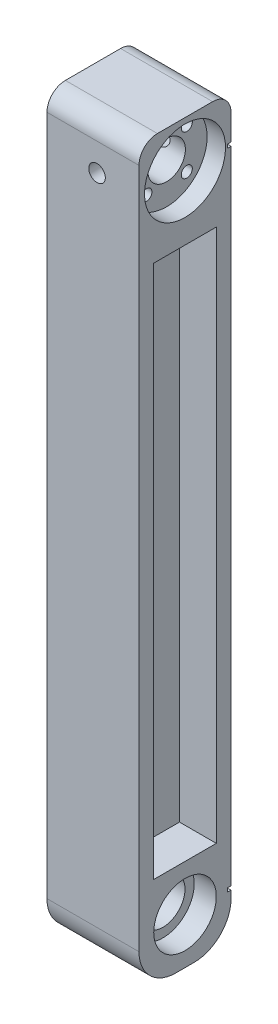
from build123d import *

# Parameters (mm, degrees)
CROQUIS1_W              = 25
CROQUIS1_H              = 25
SALIENTE_EXTRUIR1_DEPTH = 200
REDONDEO1_R             = 10
REDONDEO2_R             = 10
REDONDEO3_R             = 5
REDONDEO4_R             = 5
CROQUIS2_R              = 11
CROQUIS2_R_2            = 8.5
CORTAR_EXTRUIR1_DEPTH   = 6
CORTAR_EXTRUIR2_START   = -6
CROQUIS3_R              = 8.5
CORTAR_EXTRUIR2_DEPTH   = 6
CROQUIS9_R              = 5.1
CROQUIS9_R_2            = 6
CORTAR_EXTRUIR6_DEPTH   = 30
CROQUIS13_W             = 1
CROQUIS13_H             = 5
CORTAR_EXTRUIR8_DEPTH   = 1
SALIENTE_EXTRUIR3_START = 1
CROQUIS14_R             = 11
CROQUIS14_R_2           = 5.1
SALIENTE_EXTRUIR3_DEPTH = 1
CROQUIS15_R             = 1.5
CORTAR_EXTRUIR9_DEPTH   = 16
CORTAR_EXTRUIR10_DEPTH  = 11
CORTAR_EXTRUIR12_REACH  = 205.101
CROQUIS18_W             = 1
CROQUIS18_H             = 1
CROQUIS19_W             = 17
CROQUIS19_H             = 145
CORTAR_EXTRUIR13_DEPTH  = 10
CROQUIS20_W             = 17
CROQUIS20_H             = 145
CORTAR_EXTRUIR14_DEPTH  = 10
CROQUIS12_R             = 2.25
CORTAR_EXTRUIR7_DEPTH   = 204.100960116


with BuildPart() as part:
    # Croquis1 → Saliente-Extruir1 (new body)
    with BuildSketch(Plane(origin=(0, 0, 0), x_dir=(1, 0, 0), z_dir=(0, 1, 0))):
        with Locations((12.5, 12.5)):
            Rectangle(CROQUIS1_W, CROQUIS1_H)
    extrude(amount=SALIENTE_EXTRUIR1_DEPTH)

    # Redondeo1
    redondeo1_edges = [part.edges().sort_by_distance(p)[0] for p in [
        (12.5, 0, -25),
    ]]
    fillet(redondeo1_edges, radius=REDONDEO1_R)

    # Redondeo2
    redondeo2_edges = [part.edges().sort_by_distance(p)[0] for p in [
        (12.5, 0, 0),
    ]]
    fillet(redondeo2_edges, radius=REDONDEO2_R)

    # Redondeo3
    redondeo3_edges = [part.edges().sort_by_distance(p)[0] for p in [
        (12.5, 200, 0),
    ]]
    fillet(redondeo3_edges, radius=REDONDEO3_R)

    # Redondeo4
    redondeo4_edges = [part.edges().sort_by_distance(p)[0] for p in [
        (12.5, 200, -25),
    ]]
    fillet(redondeo4_edges, radius=REDONDEO4_R)

    # Croquis2 → Cortar-Extruir1 (cut)
    with BuildSketch(Plane(origin=(25, 0, 0), x_dir=(0, 0, -1), z_dir=(1, 0, 0))):
        with Locations((12.5, 187.5)):
            Circle(CROQUIS2_R)
        with Locations(Location((12.5, 12.5, 0), (0, 0, 180))):
            Circle(CROQUIS2_R_2)
    extrude(amount=-CORTAR_EXTRUIR1_DEPTH, mode=Mode.SUBTRACT)

    # Croquis3 → Cortar-Extruir2 (cut)
    with BuildSketch(Plane.ZY.offset(CORTAR_EXTRUIR2_START)):
        with Locations((-12.5, 12.5)):
            Circle(CROQUIS3_R)
        with Locations(Location((-12.5, 187.5, 0), (0, 0, 180))):
            Circle(CROQUIS3_R)
    extrude(amount=CORTAR_EXTRUIR2_DEPTH, mode=Mode.SUBTRACT)

    # Croquis9 → Cortar-Extruir6 (cut)
    with BuildSketch(Plane(origin=(19, 0, 0), x_dir=(0, 0, -1), z_dir=(1, 0, 0))):
        with Locations((12.5, 187.5)):
            Circle(CROQUIS9_R)
        with Locations((12.5, 12.5)):
            Circle(CROQUIS9_R_2)
    extrude(amount=-CORTAR_EXTRUIR6_DEPTH, mode=Mode.SUBTRACT)

    # Croquis13 → Cortar-Extruir8 (cut)
    with BuildSketch(Plane(origin=(0, 0, -25), x_dir=(-1, 0, 0), z_dir=(0, 0, -1))):
        with Locations((-12.5, 187.04733642)):
            Rectangle(CROQUIS13_W, CROQUIS13_H)
    extrude(amount=-CORTAR_EXTRUIR8_DEPTH, mode=Mode.SUBTRACT)

    # Croquis14 → Saliente-Extruir3 (add)
    with BuildSketch(Plane(origin=(19, 0, 0), x_dir=(0, 0, -1), z_dir=(1, 0, 0)).offset(SALIENTE_EXTRUIR3_START)):
        with Locations((12.5, 187.5)):
            Circle(CROQUIS14_R)
        with Locations((12.5, 187.5)):
            Circle(CROQUIS14_R_2, mode=Mode.SUBTRACT)
    extrude(amount=-SALIENTE_EXTRUIR3_DEPTH)

    # Croquis15 → Cortar-Extruir9 (cut)
    with BuildSketch(Plane(origin=(20, 0, 0), x_dir=(0, 0, -1), z_dir=(1, 0, 0))):
        with Locations((17.980077554, 182.019922446)):
            Circle(CROQUIS15_R)
        with Locations((7.019922446, 182.019922446)):
            Circle(CROQUIS15_R)
        with Locations((7.019922446, 192.980077554)):
            Circle(CROQUIS15_R)
        with Locations((17.980077554, 192.980077554)):
            Circle(CROQUIS15_R)
    extrude(amount=-CORTAR_EXTRUIR9_DEPTH, mode=Mode.SUBTRACT)

    # Croquis16 → Cortar-Extruir10 (cut)
    with BuildSketch(Plane.ZY):
        Polygon((-14.829996635, 192.251844396), (-15.774368679, 195.344011075), (-18.924449599, 196.072244234), (-21.130158474, 193.708310713), (-20.185786429, 190.616144033), (-17.035705509, 189.887910875), align=None)
        Polygon((-17.251844396, 185.170003365), (-20.344011075, 184.225631321), (-21.072244234, 181.075550401), (-18.708310713, 178.869841526), (-15.616144033, 179.814213571), (-14.887910875, 182.964294491), align=None)
        Polygon((-7.748155604, 189.829996635), (-4.655988925, 190.774368679), (-3.927755766, 193.924449599), (-6.291689287, 196.130158474), (-9.383855967, 195.185786429), (-10.112089125, 192.035705509), align=None)
        Polygon((-10.170003365, 182.748155604), (-9.225631321, 179.655988925), (-6.075550401, 178.927755766), (-3.869841526, 181.291689287), (-4.814213571, 184.383855967), (-7.964294491, 185.112089125), align=None)
    extrude(amount=-CORTAR_EXTRUIR10_DEPTH, mode=Mode.SUBTRACT)

    # Cortar-Extruir12: up to this face of the body (flat: up to its plane)
    cortar_extruir12_end = Plane(part.part.faces().sort_by_distance((0, 99.909973265, -12.5))[0])
    # Croquis18 → Cortar-Extruir12 (cut, up to the picked face)
    with BuildSketch(Plane(origin=(25, 0, 0), x_dir=(0, 0, -1), z_dir=(1, 0, 0)), mode=Mode.PRIVATE) as cortar_extruir12_sk1:
        with Locations((24.5, 187.5)):
            Rectangle(CROQUIS18_W, CROQUIS18_H)
    cortar_extruir12_tool1 = split(extrude(cortar_extruir12_sk1.sketch, amount=-CORTAR_EXTRUIR12_REACH, mode=Mode.PRIVATE), bisect_by=cortar_extruir12_end, keep=Keep.BOTH, mode=Mode.PRIVATE)
    # Croquis18 → Cortar-Extruir12 (cut, up to the picked face)
    with BuildSketch(Plane(origin=(25, 0, 0), x_dir=(0, 0, -1), z_dir=(1, 0, 0)), mode=Mode.PRIVATE) as cortar_extruir12_sk2:
        with Locations((24.5, 12.5)):
            Rectangle(CROQUIS18_W, CROQUIS18_H)
    cortar_extruir12_tool2 = split(extrude(cortar_extruir12_sk2.sketch, amount=-CORTAR_EXTRUIR12_REACH, mode=Mode.PRIVATE), bisect_by=cortar_extruir12_end, keep=Keep.BOTH, mode=Mode.PRIVATE)
    add(cortar_extruir12_tool1.solids().sort_by(Axis((25, 187.5, -24.5), (-1, 0, 0)))[0], mode=Mode.SUBTRACT)
    add(cortar_extruir12_tool2.solids().sort_by(Axis((25, 12.5, -24.5), (-1, 0, 0)))[0], mode=Mode.SUBTRACT)

    # Croquis19 → Cortar-Extruir13 (cut)
    with BuildSketch(Plane(origin=(25, 0, 0), x_dir=(0, 0, -1), z_dir=(1, 0, 0))):
        with Locations((12.5, 97.5)):
            Rectangle(CROQUIS19_W, CROQUIS19_H)
    extrude(amount=-CORTAR_EXTRUIR13_DEPTH, mode=Mode.SUBTRACT)

    # Croquis20 → Cortar-Extruir14 (cut)
    with BuildSketch(Plane.ZY):
        with Locations((-12.5, 97.5)):
            Rectangle(CROQUIS20_W, CROQUIS20_H)
    extrude(amount=-CORTAR_EXTRUIR14_DEPTH, mode=Mode.SUBTRACT)

    # Croquis12 → Cortar-Extruir7 (cut, through all)
    with BuildSketch(Plane(origin=(0, 0, -25), x_dir=(-1, 0, 0), z_dir=(0, 0, -1))):
        with Locations((-13.6, 187.5)):
            Circle(CROQUIS12_R)
    extrude(amount=-CORTAR_EXTRUIR7_DEPTH, mode=Mode.SUBTRACT)


solid = part.part
